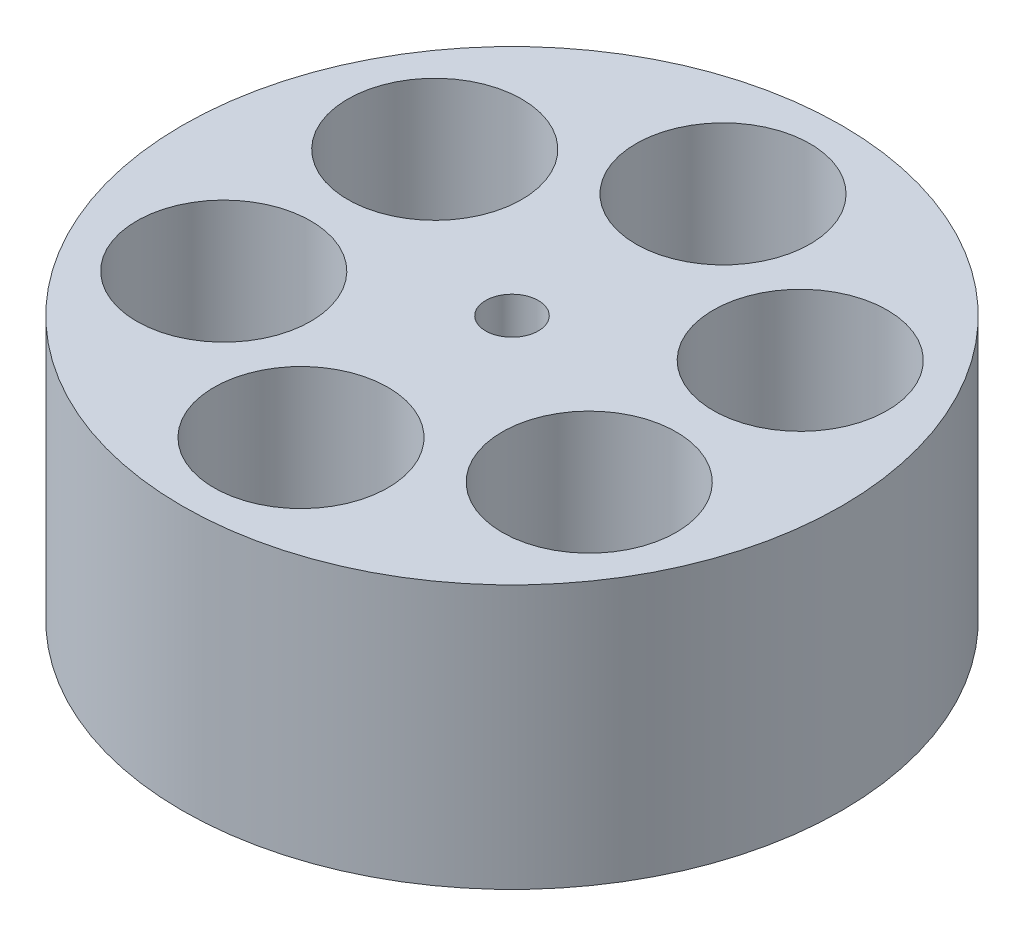
from build123d import *

# Parameters (mm, degrees)
SKETCH1_R           = 25
BOSS_EXTRUDE1_DEPTH = 20
SKETCH2_R           = 6.6
CUT_EXTRUDE1_DEPTH  = 10
SKETCH3_R           = 2
CUT_EXTRUDE2_DEPTH  = 35
CIRPATTERN1_COUNT   = 6


with BuildPart() as part:
    # Sketch1 → Boss-Extrude1 (new body)
    with BuildSketch(Plane(origin=(0, 0, 0), x_dir=(1, 0, 0), z_dir=(0, 1, 0))):
        with Locations(Location((0, 0, 0), (0, 0, 270))):
            Circle(SKETCH1_R)
    extrude(amount=BOSS_EXTRUDE1_DEPTH)

    # Sketch2 → Cut-Extrude1 (cut)
    with BuildSketch(Plane(origin=(0, 20, 0), x_dir=(1, 0, 0), z_dir=(0, 1, 0))):
        with Locations(Location((0, 16, 0), (0, 0, 270))):
            Circle(SKETCH2_R)
    cut_extrude1 = extrude(amount=-CUT_EXTRUDE1_DEPTH, mode=Mode.SUBTRACT)

    # Sketch3 → Cut-Extrude2 (cut)
    with BuildSketch(Plane(origin=(0, 10, 0), x_dir=(1, 0, 0), z_dir=(0, 1, 0))):
        with Locations(Location((0, 16, 0), (0, 0, 270))):
            Circle(SKETCH3_R)
    cut_extrude2 = extrude(amount=-CUT_EXTRUDE2_DEPTH, mode=Mode.SUBTRACT)

    # CirPattern1: Cut-Extrude1, Cut-Extrude2 ×6 about axis
    cirpattern1_axis = Axis((0, 0, 0), (0, 1, 0))
    add([cut_extrude1.rotate(cirpattern1_axis, i * 360 / CIRPATTERN1_COUNT) for i in range(1, CIRPATTERN1_COUNT)], mode=Mode.SUBTRACT)
    add([cut_extrude2.rotate(cirpattern1_axis, i * 360 / CIRPATTERN1_COUNT) for i in range(1, CIRPATTERN1_COUNT)], mode=Mode.SUBTRACT)

    # Sketch5 → Cut-Revolve1 (revolve, cut)
    with BuildSketch(Plane.XY, mode=Mode.PRIVATE) as cut_revolve1_sk:
        Polygon((0, 20), (-2, 20), (-2, 7), (-5, 4), (-5, 0), (0, 0), align=None)
    revolve(cut_revolve1_sk.sketch.rotate(Axis((0, 26.035493364, 0), (0, -1, 0)), 270), axis=Axis((0, 26.035493364, 0), (0, -1, 0)), mode=Mode.SUBTRACT)


solid = part.part
